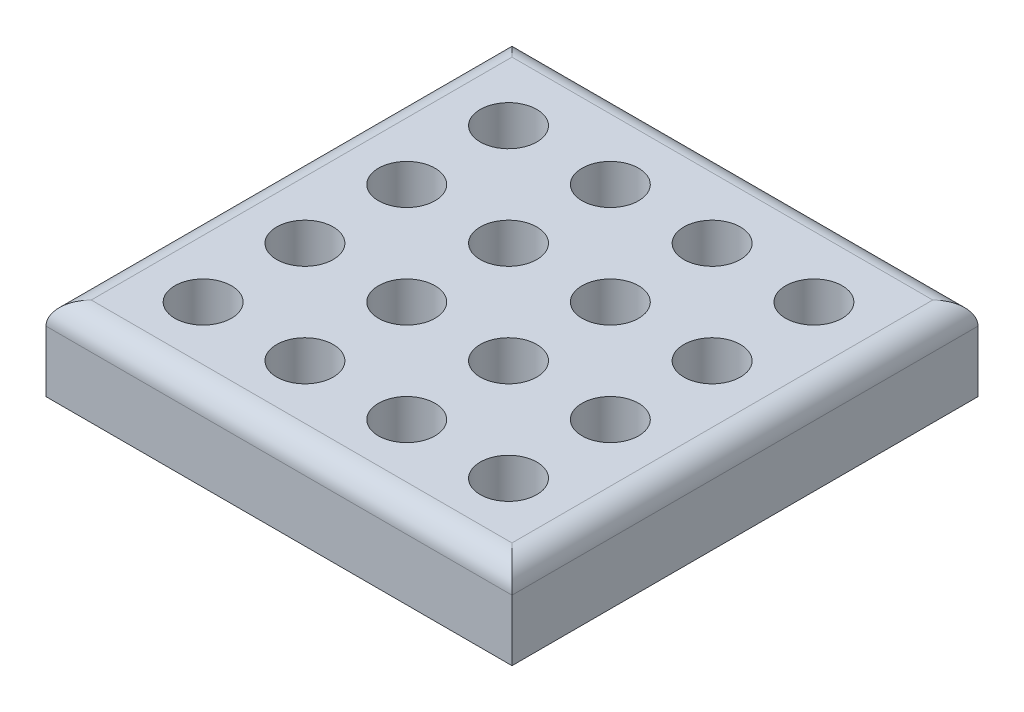
from build123d import *

# Parameters (mm, degrees)
SKETCH1_W           = 206
SKETCH1_H           = 206
BOSS_EXTRUDE1_DEPTH = 37
SKETCH2_R           = 12.5
CUT_EXTRUDE1_DEPTH  = 30
LPATTERN1_COUNT     = 4
LPATTERN1_PITCH     = 45
FILLET2_R           = 10


with BuildPart() as part:
    # Sketch1 → Boss-Extrude1 (new body)
    with BuildSketch(Plane(origin=(0, 0, 0), x_dir=(1, 0, 0), z_dir=(0, 1, 0))):
        with Locations((103, 103)):
            Rectangle(SKETCH1_W, SKETCH1_H)
    extrude(amount=BOSS_EXTRUDE1_DEPTH)

    # Sketch2 → Cut-Extrude1 (cut)
    with BuildSketch(Plane(origin=(0, 37, 0), x_dir=(1, 0, 0), z_dir=(0, 1, 0))):
        with Locations(Location((80.5, 168.965188792, 0), (0, 0, 270))):
            Circle(SKETCH2_R)
        with Locations(Location((35.5, 168.965188792, 0), (0, 0, 270))):
            Circle(SKETCH2_R)
        with Locations(Location((125.5, 168.965188792, 0), (0, 0, 270))):
            Circle(SKETCH2_R)
        with Locations(Location((170.5, 168.965188792, 0), (0, 0, 270))):
            Circle(SKETCH2_R)
    cut_extrude1 = extrude(amount=-CUT_EXTRUDE1_DEPTH, mode=Mode.SUBTRACT)

    # LPattern1: Cut-Extrude1 ×4
    with Locations(*[(0, 0, i * LPATTERN1_PITCH) for i in range(1, LPATTERN1_COUNT)]):
        add(cut_extrude1, mode=Mode.SUBTRACT)

    # Fillet2
    fillet2_edges = [part.edges().sort_by_distance(p)[0] for p in [
        (206, 37, -103),
        (103, 37, -206),
        (0, 37, -103),
        (103, 37, 0),
    ]]
    fillet(fillet2_edges, radius=FILLET2_R)


solid = part.part
